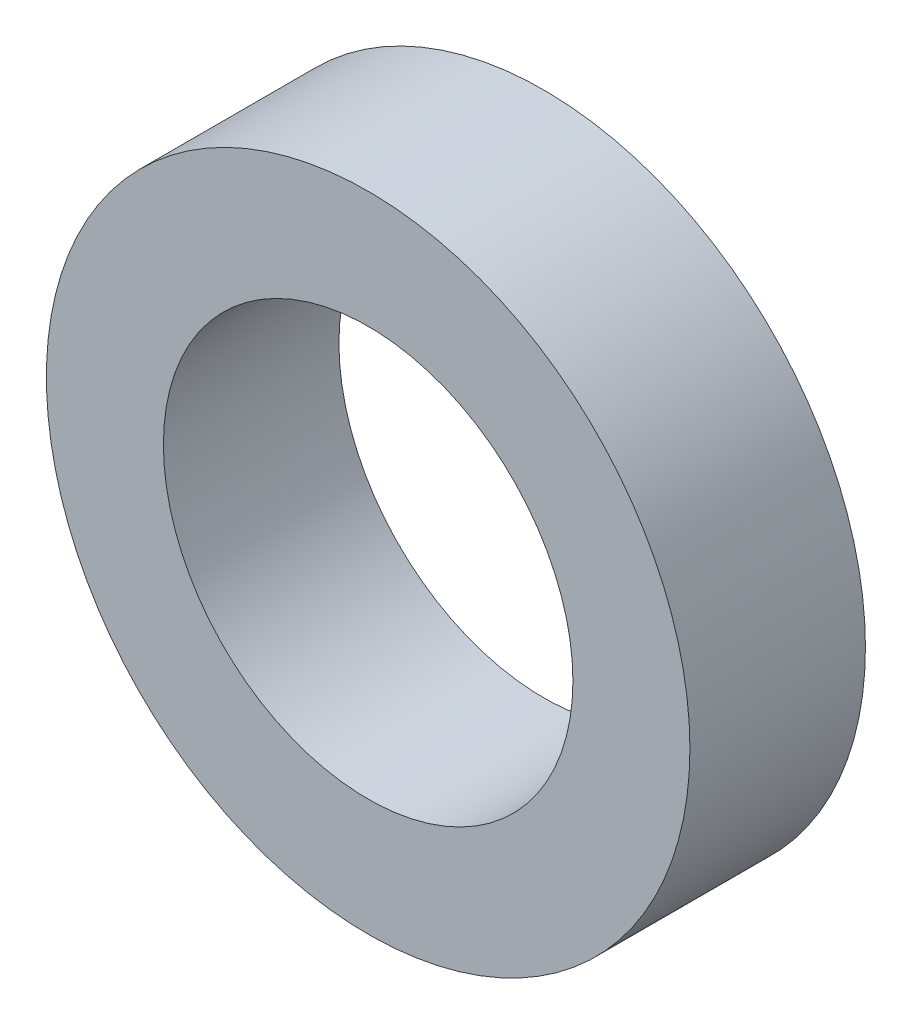
from build123d import *

# Parameters (mm, degrees)
SKETCH_1_R      = 5.5
SKETCH_1_R_2    = 3.5
EXTRUDE_1_DEPTH = 3


with BuildPart() as part:
    # 草图1 → 凸台-拉伸1 (new body)
    with BuildSketch(Plane.XY):
        Circle(SKETCH_1_R)
        Circle(SKETCH_1_R_2, mode=Mode.SUBTRACT)
    extrude(amount=EXTRUDE_1_DEPTH)


solid = part.part
